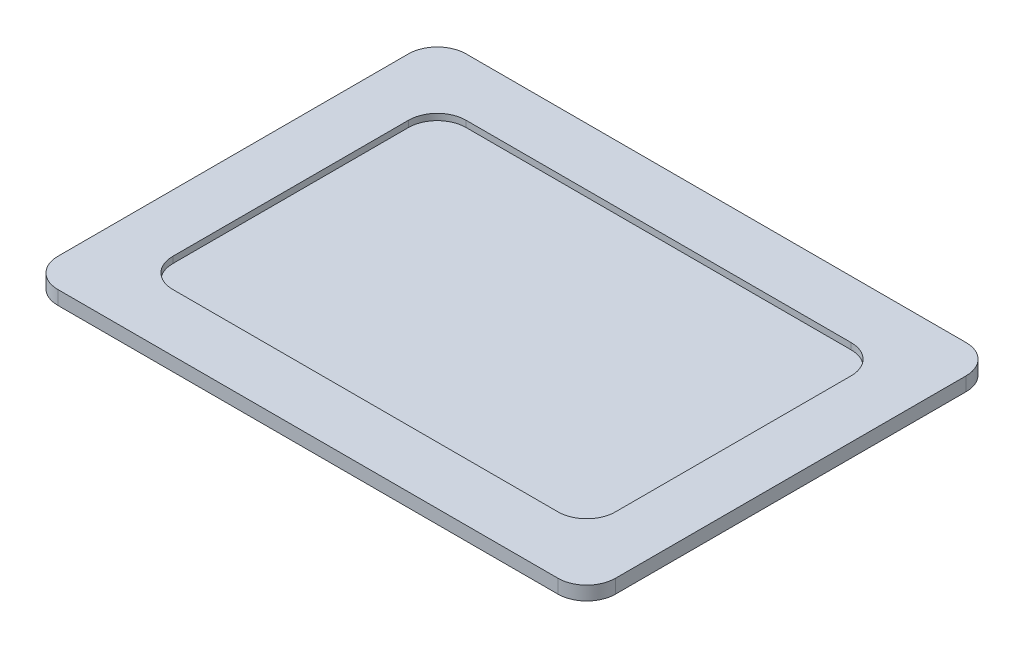
from build123d import *

# Parameters (mm, degrees)
BOSS_EXTRUDE1_DEPTH      = 1.2
BOSS_EXTRUDE1_DEPTH_BACK = 1.2
SKETCH1_W                = 97
SKETCH1_H                = 71
SKETCH2_W                = 77
SKETCH2_H                = 51
CUT_EXTRUDE1_DEPTH       = 1.1
FILLET1_R                = 5
FILLET1_OF_MIRROR3_R     = 5
FILLET2_R                = 5


with BuildPart() as part:
    # Sketch1 → Boss-Extrude1 (new, two sides: drawn at the far end of the back side and taken through both)
    with BuildSketch(Plane(origin=(0, 0, 0), x_dir=(1, 0, 0), z_dir=(0, 1, 0)).offset(-BOSS_EXTRUDE1_DEPTH_BACK)):
        Rectangle(SKETCH1_W, SKETCH1_H)
    extrude(amount=BOSS_EXTRUDE1_DEPTH + BOSS_EXTRUDE1_DEPTH_BACK)

    # Sketch2 → Cut-Extrude1 (cut)
    with BuildSketch(Plane(origin=(0, 1.2, 0), x_dir=(1, 0, 0), z_dir=(0, 1, 0))):
        Rectangle(SKETCH2_W, SKETCH2_H)
    cut_extrude1 = extrude(amount=-CUT_EXTRUDE1_DEPTH, mode=Mode.SUBTRACT)

    # Fillet1
    fillet1_edges = [part.edges().sort_by_distance(p)[0] for p in [
        (38.5, 0.65, 25.5),
        (-38.5, 0.65, 25.5),
        (-38.5, 0.65, -25.5),
        (38.5, 0.65, -25.5),
    ]]
    fillet(fillet1_edges, radius=FILLET1_R)

    # Mirror3: Cut-Extrude1 across plane
    add(cut_extrude1.mirror(Plane.ZX), mode=Mode.SUBTRACT)

    # Fillet1 of Mirror3
    fillet1_of_mirror3_edges = [part.edges().sort_by_distance(p)[0] for p in [
        (38.5, -0.65, 25.5),
        (-38.5, -0.65, 25.5),
        (-38.5, -0.65, -25.5),
        (38.5, -0.65, -25.5),
    ]]
    fillet(fillet1_of_mirror3_edges, radius=FILLET1_OF_MIRROR3_R)

    # Fillet2
    fillet2_edges = [part.edges().sort_by_distance(p)[0] for p in [
        (48.5, 0, 35.5),
        (-48.5, 0, 35.5),
        (-48.5, 0, -35.5),
        (48.5, 0, -35.5),
    ]]
    fillet(fillet2_edges, radius=FILLET2_R)


solid = part.part
